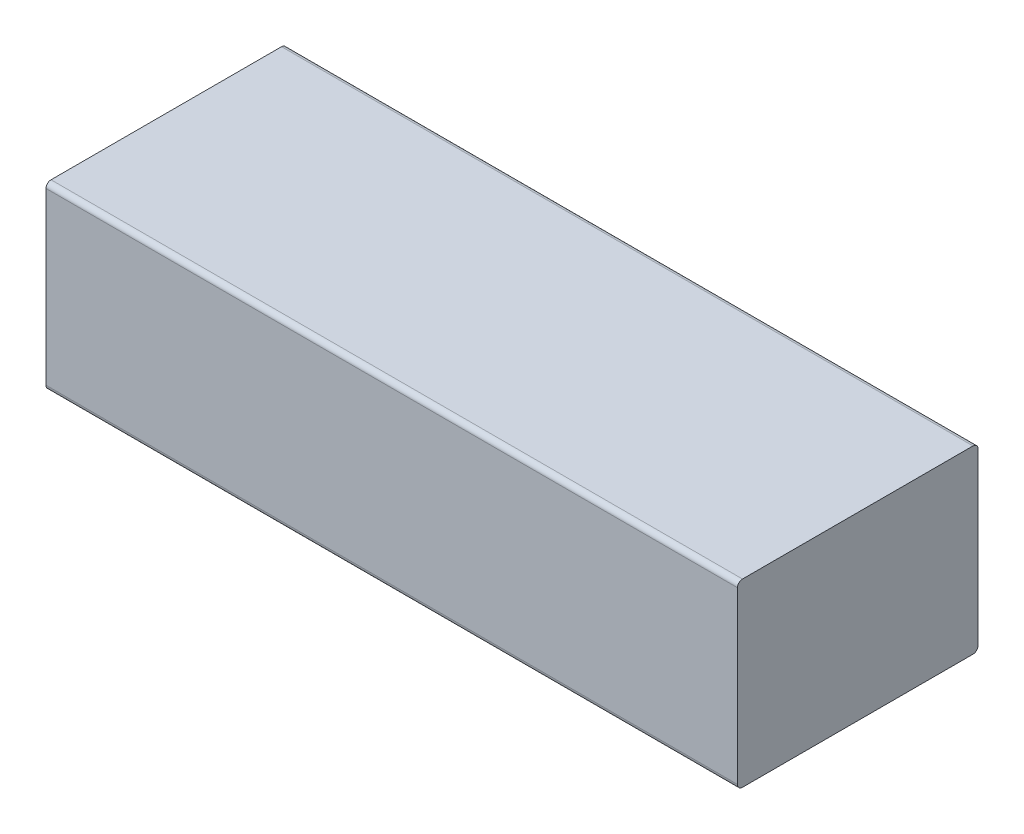
from build123d import *

# Parameters (mm, degrees)
SKETCH1_W           = 138
SKETCH1_H           = 36
BOSS_EXTRUDE1_DEPTH = 48
FILLET2_R           = 1
SKETCH2_W           = 5.121114637
SKETCH2_H           = 9.72723973
CUT_EXTRUDE1_DEPTH  = 4


with BuildPart() as part:
    # Sketch1 → Boss-Extrude1 (new body)
    with BuildSketch(Plane.XY):
        with Locations((69, 18)):
            Rectangle(SKETCH1_W, SKETCH1_H)
    extrude(amount=-BOSS_EXTRUDE1_DEPTH)

    # Fillet2
    fillet2_edges = [part.edges().sort_by_distance(p)[0] for p in [
        (69, 36, -48),
        (69, 36, 0),
        (69, 0, 0),
        (69, 0, -48),
    ]]
    fillet(fillet2_edges, radius=FILLET2_R)

    # Sketch2 → Cut-Extrude1 (cut)
    with BuildSketch(Plane.XZ):
        with Locations((2.560557319, -8.237193023)):
            Rectangle(SKETCH2_W, SKETCH2_H)
    extrude(amount=-CUT_EXTRUDE1_DEPTH, mode=Mode.SUBTRACT)


solid = part.part
